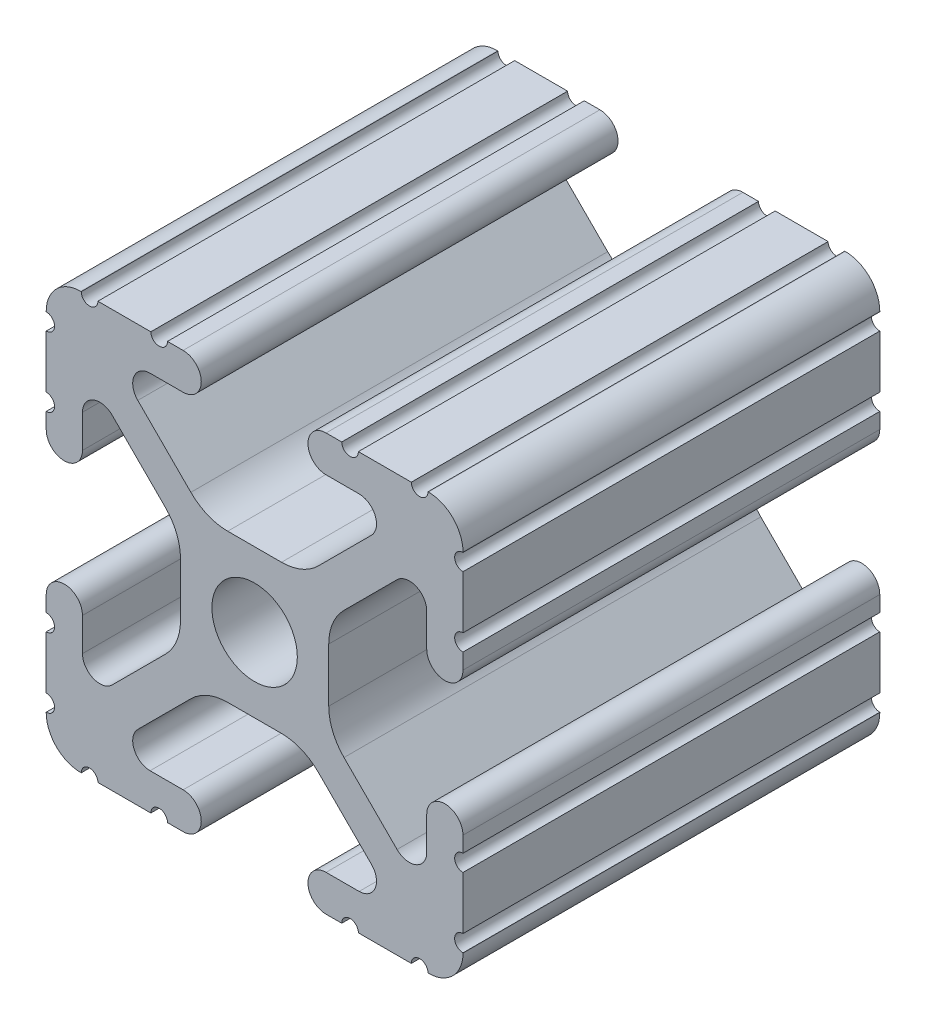
from build123d import *

# Parameters (mm, degrees)
SKETCH1_R      = 2.6035
EXTRUDE1_DEPTH = 25.4


with BuildPart() as part:
    # Sketch1 → Extrude1 (new body)
    with BuildSketch(Plane.XY):
        with BuildLine():
            Line((10.5918, 12.7), (10.5664, 12.7))
            ThreePointArc((10.5664, 12.7), (10.0584, 12.192), (9.5504, 12.7))
            Line((9.5504, 12.7), (6.3246, 12.7))
            ThreePointArc((6.3246, 12.7), (5.8166, 12.192), (5.3086, 12.7))
            Line((5.3086, 12.7), (4.3561, 12.7))
            ThreePointArc((4.3561, 12.7), (3.2512, 11.5951), (4.3561, 10.4902))
            Line((4.3561, 10.4902), (6.370083786, 10.4902))
            ThreePointArc((6.370083786, 10.4902), (7.348856743, 9.836204819), (7.119204175, 8.681663397))
            Line((7.119204175, 8.681663397), (3.88464389, 5.447103113))
            ThreePointArc((3.88464389, 5.447103113), (2.854599758, 4.758849627), (1.63957986, 4.517167143))
            Line((1.63957986, 4.517167143), (-1.63957986, 4.517167143))
            ThreePointArc((-1.63957986, 4.517167143), (-2.854599758, 4.758849627), (-3.88464389, 5.447103113))
            Line((-3.88464389, 5.447103113), (-7.119204175, 8.681663397))
            ThreePointArc((-7.119204175, 8.681663397), (-7.348856743, 9.836204819), (-6.370083786, 10.4902))
            Line((-6.370083786, 10.4902), (-4.3561, 10.4902))
            ThreePointArc((-4.3561, 10.4902), (-3.2512, 11.5951), (-4.3561, 12.7))
            Line((-4.3561, 12.7), (-5.3086, 12.7))
            ThreePointArc((-5.3086, 12.7), (-5.8166, 12.192), (-6.3246, 12.7))
            Line((-6.3246, 12.7), (-9.5504, 12.7))
            ThreePointArc((-9.5504, 12.7), (-10.0584, 12.192), (-10.5664, 12.7))
            Line((-10.5664, 12.7), (-10.5918, 12.7))
            ThreePointArc((-10.5918, 12.7), (-12.082522516, 12.082522516), (-12.7, 10.5918))
            Line((-12.7, 10.5918), (-12.7, 10.5664))
            ThreePointArc((-12.7, 10.5664), (-12.192, 10.0584), (-12.7, 9.5504))
            Line((-12.7, 9.5504), (-12.7, 6.3246))
            ThreePointArc((-12.7, 6.3246), (-12.192, 5.8166), (-12.7, 5.3086))
            Line((-12.7, 5.3086), (-12.7, 4.3561))
            ThreePointArc((-12.7, 4.3561), (-11.5951, 3.2512), (-10.4902, 4.3561))
            Line((-10.4902, 4.3561), (-10.4902, 6.370083786))
            ThreePointArc((-10.4902, 6.370083786), (-9.836204819, 7.348856743), (-8.681663397, 7.119204175))
            Line((-8.681663397, 7.119204175), (-5.447103113, 3.88464389))
            ThreePointArc((-5.447103113, 3.88464389), (-4.758849627, 2.854599758), (-4.517167143, 1.63957986))
            Line((-4.517167143, 1.63957986), (-4.517167143, -1.63957986))
            ThreePointArc((-4.517167143, -1.63957986), (-4.758849627, -2.854599758), (-5.447103113, -3.88464389))
            Line((-5.447103113, -3.88464389), (-8.681663397, -7.119204175))
            ThreePointArc((-8.681663397, -7.119204175), (-9.836204819, -7.348856743), (-10.4902, -6.370083786))
            Line((-10.4902, -6.370083786), (-10.4902, -4.3561))
            ThreePointArc((-10.4902, -4.3561), (-11.5951, -3.2512), (-12.7, -4.3561))
            Line((-12.7, -4.3561), (-12.7, -5.3086))
            ThreePointArc((-12.7, -5.3086), (-12.192, -5.8166), (-12.7, -6.3246))
            Line((-12.7, -6.3246), (-12.7, -9.5504))
            ThreePointArc((-12.7, -9.5504), (-12.192, -10.0584), (-12.7, -10.5664))
            Line((-12.7, -10.5664), (-12.7, -10.5918))
            ThreePointArc((-12.7, -10.5918), (-12.082522516, -12.082522516), (-10.5918, -12.7))
            Line((-10.5918, -12.7), (-10.5664, -12.7))
            ThreePointArc((-10.5664, -12.7), (-10.0584, -12.192), (-9.5504, -12.7))
            Line((-9.5504, -12.7), (-6.3246, -12.7))
            ThreePointArc((-6.3246, -12.7), (-5.8166, -12.192), (-5.3086, -12.7))
            Line((-5.3086, -12.7), (-4.3561, -12.7))
            ThreePointArc((-4.3561, -12.7), (-3.2512, -11.5951), (-4.3561, -10.4902))
            Line((-4.3561, -10.4902), (-6.370083786, -10.4902))
            ThreePointArc((-6.370083786, -10.4902), (-7.348856743, -9.836204819), (-7.119204175, -8.681663397))
            Line((-7.119204175, -8.681663397), (-3.88464389, -5.447103113))
            ThreePointArc((-3.88464389, -5.447103113), (-2.854599758, -4.758849627), (-1.63957986, -4.517167143))
            Line((-1.63957986, -4.517167143), (1.63957986, -4.517167143))
            ThreePointArc((1.63957986, -4.517167143), (2.854599758, -4.758849627), (3.88464389, -5.447103113))
            Line((3.88464389, -5.447103113), (7.119204175, -8.681663397))
            ThreePointArc((7.119204175, -8.681663397), (7.348856743, -9.836204819), (6.370083786, -10.4902))
            Line((6.370083786, -10.4902), (4.3561, -10.4902))
            ThreePointArc((4.3561, -10.4902), (3.2512, -11.5951), (4.3561, -12.7))
            Line((4.3561, -12.7), (5.3086, -12.7))
            ThreePointArc((5.3086, -12.7), (5.8166, -12.192), (6.3246, -12.7))
            Line((6.3246, -12.7), (9.5504, -12.7))
            ThreePointArc((9.5504, -12.7), (10.0584, -12.192), (10.5664, -12.7))
            Line((10.5664, -12.7), (10.5918, -12.7))
            ThreePointArc((10.5918, -12.7), (12.082522516, -12.082522516), (12.7, -10.5918))
            Line((12.7, -10.5918), (12.7, -10.5664))
            ThreePointArc((12.7, -10.5664), (12.192, -10.0584), (12.7, -9.5504))
            Line((12.7, -9.5504), (12.7, -6.3246))
            ThreePointArc((12.7, -6.3246), (12.192, -5.8166), (12.7, -5.3086))
            Line((12.7, -5.3086), (12.7, -4.3561))
            ThreePointArc((12.7, -4.3561), (11.5951, -3.2512), (10.4902, -4.3561))
            Line((10.4902, -4.3561), (10.4902, -6.370083786))
            ThreePointArc((10.4902, -6.370083786), (9.836204819, -7.348856743), (8.681663397, -7.119204175))
            Line((8.681663397, -7.119204175), (5.447103113, -3.88464389))
            ThreePointArc((5.447103113, -3.88464389), (4.758849627, -2.854599758), (4.517167143, -1.63957986))
            Line((4.517167143, -1.63957986), (4.517167143, 1.63957986))
            ThreePointArc((4.517167143, 1.63957986), (4.758849627, 2.854599758), (5.447103113, 3.88464389))
            Line((5.447103113, 3.88464389), (8.681663397, 7.119204175))
            ThreePointArc((8.681663397, 7.119204175), (9.836204819, 7.348856743), (10.4902, 6.370083786))
            Line((10.4902, 6.370083786), (10.4902, 4.3561))
            ThreePointArc((10.4902, 4.3561), (11.5951, 3.2512), (12.7, 4.3561))
            Line((12.7, 4.3561), (12.7, 5.3086))
            ThreePointArc((12.7, 5.3086), (12.192, 5.8166), (12.7, 6.3246))
            Line((12.7, 6.3246), (12.7, 9.5504))
            ThreePointArc((12.7, 9.5504), (12.192, 10.0584), (12.7, 10.5664))
            Line((12.7, 10.5664), (12.7, 10.5918))
            ThreePointArc((12.7, 10.5918), (12.082522516, 12.082522516), (10.5918, 12.7))
        make_face()
        Circle(SKETCH1_R, mode=Mode.SUBTRACT)
    extrude(amount=-EXTRUDE1_DEPTH)


solid = part.part
